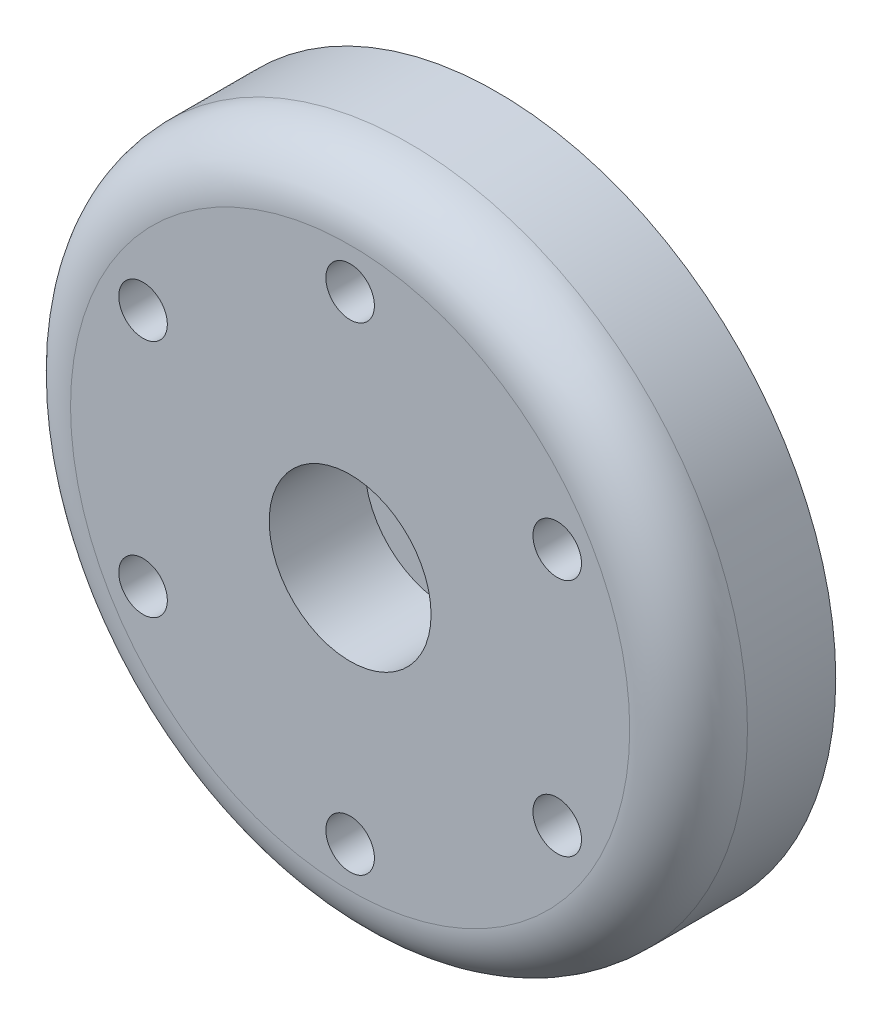
from build123d import *

# Parameters (mm, degrees)
SKETCH1_W                      = 23
SKETCH1_H                      = 10
HOLE1_D                        = 40
HOLE1_DEPTH                    = 5.8
SKETCH4_W                      = 12.5
SKETCH4_H                      = 5.8
M4X0_7_TAPPED_HOLE1_D          = 3.3
CBORE_FOR_M6_SHCS1_D           = 7
CBORE_FOR_M6_SHCS1_CBORE_D     = 11
CBORE_FOR_M6_SHCS1_CBORE_DEPTH = 6.5
FILLET1_R                      = 4


with BuildPart() as part:
    # Sketch1 → Revolve1 (revolve)
    with BuildSketch(Plane.XZ, mode=Mode.PRIVATE) as revolve1_sk:
        with Locations((11.5, 5)):
            Rectangle(SKETCH1_W, SKETCH1_H)
    revolve(revolve1_sk.sketch.rotate(Axis((0, 0, 10), (0, 0, -1)), 180), axis=Axis((0, 0, 10), (0, 0, -1)))

    # Hole1
    with Locations(Plane(origin=(0, 0, 0), x_dir=(-1, 0, 0), z_dir=(0, 0, -1))):
        with Locations((0, 0)):
            Hole(HOLE1_D / 2, depth=HOLE1_DEPTH)

    # Sketch4 → Revolve2 (revolve)
    with BuildSketch(Plane.XZ, mode=Mode.PRIVATE) as revolve2_sk:
        with Locations((6.25, 2.9)):
            Rectangle(SKETCH4_W, SKETCH4_H)
    revolve(revolve2_sk.sketch.rotate(Axis((0, 0, 5.8), (0, 0, -1)), 180), axis=Axis((0, 0, 5.8), (0, 0, -1)))

    # M4x0.7 Tapped Hole1 (through all)
    with Locations(Plane(origin=(0, 0, 5.8), x_dir=(-1, 0, 0), z_dir=(0, 0, -1))):
        with Locations((-14.072912811, 8.125), (-14.072912811, -8.125), (0, -16.25), (14.072912811, -8.125), (14.072912811, 8.125), (0, 16.25)):
            Hole(M4X0_7_TAPPED_HOLE1_D / 2)

    # CBORE for M6 SHCS1 (through all)
    with Locations(Plane.XY.offset(10)):
        with Locations((0, 0)):
            CounterBoreHole(CBORE_FOR_M6_SHCS1_D / 2, CBORE_FOR_M6_SHCS1_CBORE_D / 2, CBORE_FOR_M6_SHCS1_CBORE_DEPTH)

    # Fillet1
    fillet1_edges = [part.edges().sort_by_distance(p)[0] for p in [
        (23, 0, 10),
    ]]
    fillet(fillet1_edges, radius=FILLET1_R)


solid = part.part
